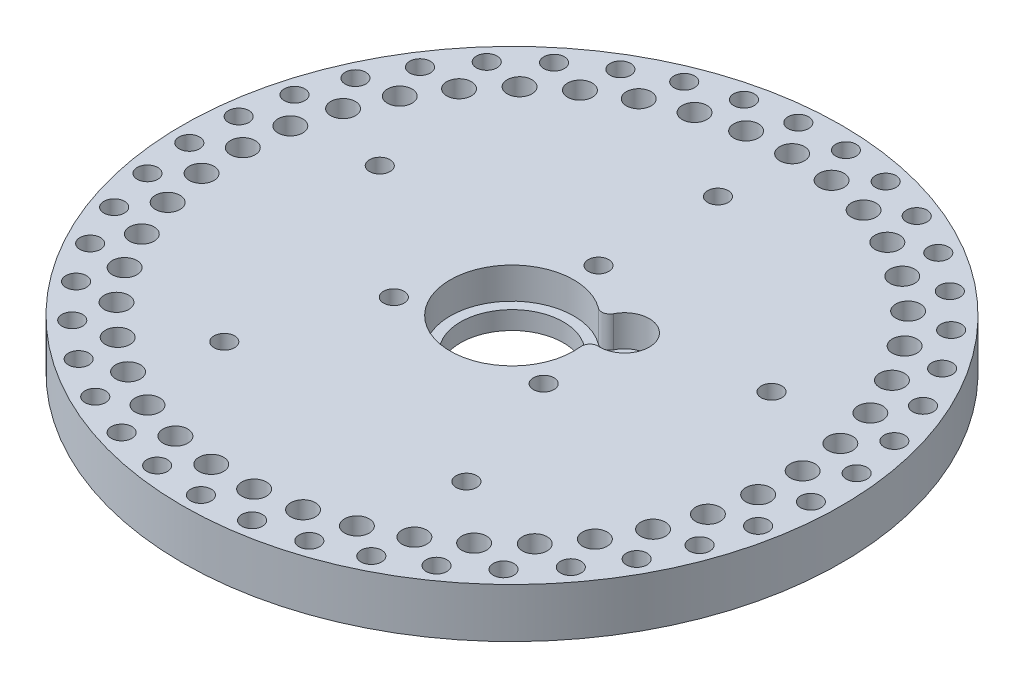
from build123d import *

# Parameters (mm, degrees)
SKETCH1_R                          = 40
PODSTAWA_DEPTH                     = 6
PRZELOT_SPRZEGLA_REACH             = 58.886
SKETCH2_R                          = 7.5
PRZELOT_SPRZEGLA_DIRECTION_2_DEPTH = 57.885850613
WALKI_CYKLOIDY_D                   = 3
TAP_DRILL_FOR_M3_TAP1_D            = 2.5
PROG_START                         = 2.2
SKETCH9_R                          = 7.5
SKETCH9_R_2                        = 6.25
PROG_LOZYSKA_DEPTH                 = 2.2
TAP_DRILL_FOR_M3_TAP2_D            = 2.5
SKETCH12_R                         = 3
CUT_EXTRUDE1_DEPTH                 = 3.8
FILLET1_R                          = 1
TAP_DRILL_FOR_M3_TAP3_D            = 2.5
TAP_DRILL_FOR_M3_TAP3_DEPTH        = 6
TAP_DRILL_FOR_M3_TAP3_TIP          = 0.751075774


with BuildPart() as part:
    # Sketch1 → podstawa (new body)
    with BuildSketch(Plane(origin=(0, 0, 0), x_dir=(1, 0, 0), z_dir=(0, 1, 0))):
        with Locations(Location((0, 0, 0), (0, 0, 270))):
            Circle(SKETCH1_R)
    extrude(amount=PODSTAWA_DEPTH)

    # Sketch2 → przelot sprzegla (cut, up to next)
    with BuildSketch(Plane(origin=(0, 6, 0), x_dir=(1, 0, 0), z_dir=(0, 1, 0)), mode=Mode.PRIVATE) as przelot_sprzegla_sk1:
        with Locations(Location((0, 0, 0), (0, 0, 90))):
            Circle(SKETCH2_R)
    przelot_sprzegla_tool1 = extrude(przelot_sprzegla_sk1.sketch, amount=-PRZELOT_SPRZEGLA_REACH, mode=Mode.PRIVATE) & part.part
    add(przelot_sprzegla_tool1.solids().sort_by_distance((0, 6, 0))[0], mode=Mode.SUBTRACT)

    # Sketch2 → przelot sprzegla direction 2 (cut)
    with BuildSketch(Plane(origin=(0, 6, 0), x_dir=(1, 0, 0), z_dir=(0, 1, 0))):
        with Locations(Location((0, 0, 0), (0, 0, 90))):
            Circle(SKETCH2_R)
    extrude(amount=PRZELOT_SPRZEGLA_DIRECTION_2_DEPTH, mode=Mode.SUBTRACT)

    # walki cykloidy (through all)
    with Locations(Plane(origin=(0, 6, 0), x_dir=(1, 0, 0), z_dir=(0, 1, 0))):
        with Locations((0, 34), (5.190075663, 33.601534409), (10.258500352, 32.41547733), (15.086474487, 30.469628937), (19.560834447, 27.809598266), (23.576705027, 24.497734182), (27.039957623, 20.611663973), (29.869416531, 16.242473829), (31.998761631, 11.492573866), (33.37808288, 6.473297712), (33.975050156, 1.302292945), (33.775671052, -3.899236464), (32.784618845, -9.009371075), (31.02512296, -13.908333664), (28.538424488, -18.4812967), (25.382809535, -22.621073806), (21.632243039, -26.230632114), (17.374635101, -29.225366638), (12.709780443, -31.535083337), (7.747019303, -33.105644412), (2.602674596, -33.90023724), (-2.602674596, -33.90023724), (-7.747019303, -33.105644412), (-12.709780443, -31.535083337), (-17.374635101, -29.225366638), (-21.632243039, -26.230632114), (-25.382809535, -22.621073806), (-28.538424488, -18.4812967), (-31.02512296, -13.908333664), (-32.784618845, -9.009371075), (-33.775671052, -3.899236464), (-33.975050156, 1.302292945), (-33.37808288, 6.473297712), (-31.998761631, 11.492573866), (-29.869416531, 16.242473829), (-27.039957623, 20.611663973), (-23.576705027, 24.497734182), (-19.560834447, 27.809598266), (-15.086474487, 30.469628937), (-10.258500352, 32.41547733), (-5.190075663, 33.601534409)):
            Hole(WALKI_CYKLOIDY_D / 2)

    # Tap Drill for M3 Tap1 (through all)
    with Locations(Plane(origin=(0, 6, 0), x_dir=(1, 0, 0), z_dir=(0, 1, 0))):
        with Locations((-2.889734295, 37.639233995), (2.889734295, 37.639233995), (8.601469961, 36.757002251), (14.111594462, 35.013217529), (19.290955149, 32.448752664), (24.018152198, 29.123716538), (28.182384116, 25.116045181), (31.686044836, 20.519675013), (34.447011522, 15.442341053), (36.400569453, 10.003051708), (37.500928888, 4.329299309), (37.722298335, -1.445928197), (37.05948908, -7.187264371), (35.528036811, -12.76013716), (33.163837472, -18.033923149), (30.022305891, -22.885009264), (26.177076905, -27.199690158), (21.718279423, -30.876833369), (16.750423879, -33.830249775), (11.389952597, -35.9907138), (5.762510479, -37.307585998), (0, -37.75), (-5.762510479, -37.307585998), (-11.389952597, -35.9907138), (-16.750423879, -33.830249775), (-21.718279423, -30.876833369), (-26.177076905, -27.199690158), (-30.022305891, -22.885009264), (-33.163837472, -18.033923149), (-35.528036811, -12.76013716), (-37.05948908, -7.187264371), (-37.722298335, -1.445928197), (-37.500928888, 4.329299309), (-36.400569453, 10.003051708), (-34.447011522, 15.442341053), (-31.686044836, 20.519675013), (-28.182384116, 25.116045181), (-24.018152198, 29.123716538), (-19.290955149, 32.448752664), (-14.111594462, 35.013217529), (-8.601469961, 36.757002251)):
            Hole(TAP_DRILL_FOR_M3_TAP1_D / 2)

    # Sketch9 → prog lozyska (add)
    with BuildSketch(Plane(origin=(0, 0, 0), x_dir=(1, 0, 0), z_dir=(0, 1, 0)).offset(PROG_START)):
        with Locations(Location((0, 0, 0), (0, 0, 90))):
            Circle(SKETCH9_R)
        with Locations(Location((0, 0, 0), (0, 0, 270))):
            Circle(SKETCH9_R_2, mode=Mode.SUBTRACT)
    extrude(amount=-PROG_LOZYSKA_DEPTH)

    # Tap Drill for M3 Tap2 (through all)
    with Locations(Plane(origin=(0, 6, 0), x_dir=(1, 0, 0), z_dir=(0, 1, 0))):
        with Locations((0, 10.5), (9.09326674, -5.25), (-9.09326674, -5.25)):
            Hole(TAP_DRILL_FOR_M3_TAP2_D / 2)

    # Sketch12 → Cut-Extrude1 (cut)
    with BuildSketch(Plane(origin=(0, 6, 0), x_dir=(1, 0, 0), z_dir=(0, 1, 0))):
        with Locations((8.660254038, 5)):
            Circle(SKETCH12_R)
    extrude(amount=-CUT_EXTRUDE1_DEPTH, mode=Mode.SUBTRACT)

    # Fillet1
    fillet1_edges = [part.edges().sort_by_distance(p)[0] for p in [
        (7.090883633, 4.1, -2.443229276),
        (5.661340437, 4.1, -4.919270724),
    ]]
    fillet(fillet1_edges, radius=FILLET1_R)

    # Tap Drill for M3 Tap3
    with Locations(Plane(origin=(0, 6, 0), x_dir=(1, 0, 0), z_dir=(0, 1, 0))):
        with Locations((0, 25), (23.776412907, 7.725424859), (14.694631307, -20.225424859), (-14.694631307, -20.225424859), (-23.776412907, 7.725424859)):
            Hole(TAP_DRILL_FOR_M3_TAP3_D / 2, depth=TAP_DRILL_FOR_M3_TAP3_DEPTH)
            with Locations((0, 0, -(TAP_DRILL_FOR_M3_TAP3_DEPTH + TAP_DRILL_FOR_M3_TAP3_TIP / 2))):  # 118° drill point
                Cone(0, TAP_DRILL_FOR_M3_TAP3_D / 2, TAP_DRILL_FOR_M3_TAP3_TIP, mode=Mode.SUBTRACT)


solid = part.part
